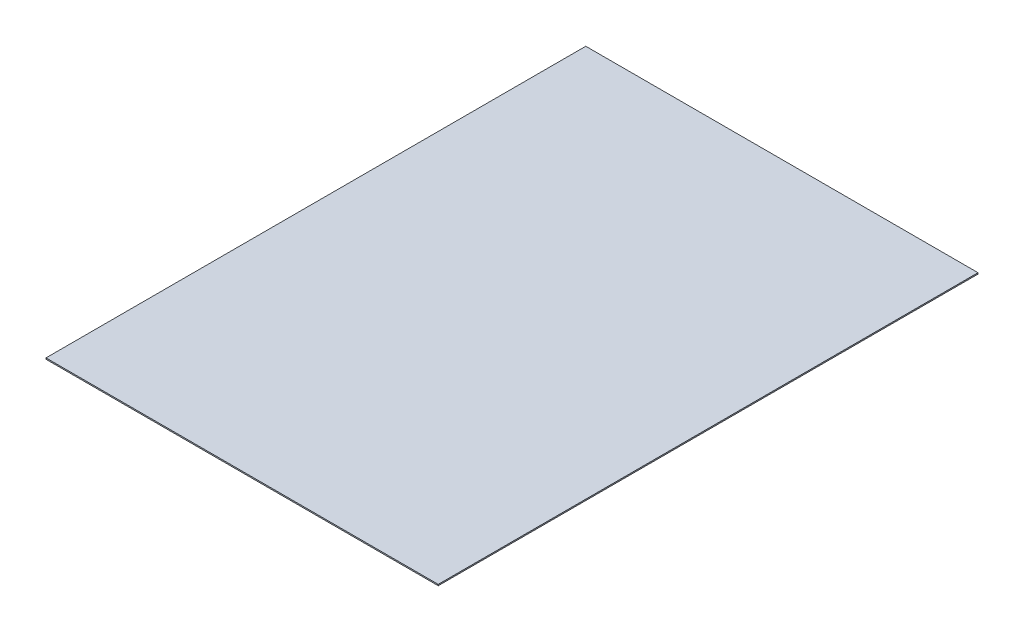
from build123d import *

# Parameters (mm, degrees)
CROQUIS1_W              = 914.3
CROQUIS1_H              = 1258.2
SALIENTE_EXTRUIR1_DEPTH = 2.9


with BuildPart() as part:
    # Croquis1 → Saliente-Extruir1 (new body)
    with BuildSketch(Plane(origin=(0, 0, 0), x_dir=(1, 0, 0), z_dir=(0, 1, 0))):
        with Locations((457.15, -629.1)):
            Rectangle(CROQUIS1_W, CROQUIS1_H)
    extrude(amount=SALIENTE_EXTRUIR1_DEPTH)


solid = part.part
